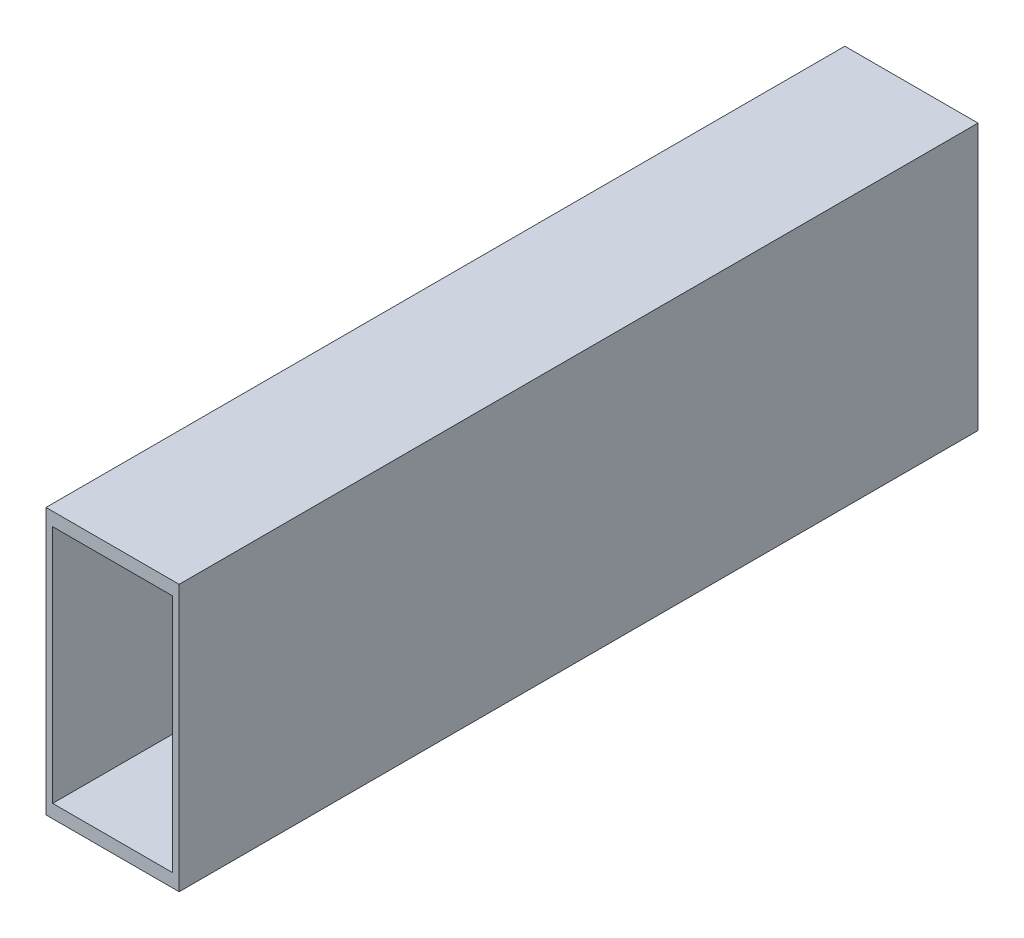
from build123d import *

# Parameters (mm, degrees)
SKETCH1_W           = 500
SKETCH1_H           = 1000
SKETCH1_W_2         = 450
SKETCH1_H_2         = 900
BOSS_EXTRUDE1_DEPTH = 1500


with BuildPart() as part:
    # Sketch1 → Boss-Extrude1 (new, symmetric)
    with BuildSketch(Plane.XY):
        Rectangle(SKETCH1_W, SKETCH1_H)
        Rectangle(SKETCH1_W_2, SKETCH1_H_2, mode=Mode.SUBTRACT)
    extrude(amount=BOSS_EXTRUDE1_DEPTH, both=True)


solid = part.part
